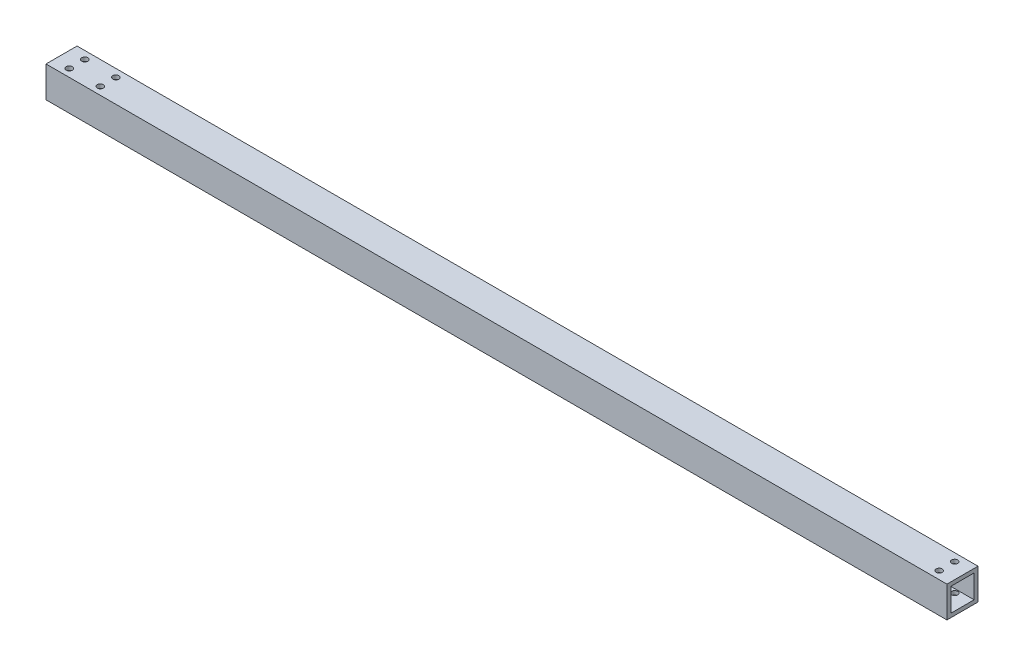
from build123d import *

# Parameters (mm, degrees)
EXTRUDE_THIN1_START             = 76.2
SKETCH5_W                       = 25.4
SKETCH5_H                       = 25.4
SKETCH5_W_2                     = 19.05
SKETCH5_H_2                     = 19.05
EXTRUDE_THIN1_DEPTH             = 736.6
F_5_0MM_DOWEL_HOLE1_D           = 5
F_5_0MM_DOWEL_HOLE1_CSINK_D     = 5.05
F_5_0MM_DOWEL_HOLE1_CSINK_ANGLE = 90


with BuildPart() as part:
    # Sketch5 → Extrude-Thin1 (new body)
    with BuildSketch(Plane(origin=(0, 0, 0), x_dir=(0, 0, -1), z_dir=(1, 0, 0)).offset(EXTRUDE_THIN1_START)):
        with Locations((101.6, 88.9)):
            Rectangle(SKETCH5_W, SKETCH5_H)
        with Locations((101.6, 88.9)):
            Rectangle(SKETCH5_W_2, SKETCH5_H_2, mode=Mode.SUBTRACT)
    extrude(amount=EXTRUDE_THIN1_DEPTH)

    # Ø5.0mm Dowel Hole1 (through all)
    with Locations(Plane(origin=(0, 76.2, 0), x_dir=(-1, 0, 0), z_dir=(0, -1, 0))):
        with Locations((-88.9, 107.95), (-88.9, 95.25), (-114.3, 107.95), (-114.3, 95.25), (-800.1, 107.95), (-800.1, 95.25)):
            CounterSinkHole(F_5_0MM_DOWEL_HOLE1_D / 2, F_5_0MM_DOWEL_HOLE1_CSINK_D / 2, counter_sink_angle=F_5_0MM_DOWEL_HOLE1_CSINK_ANGLE)


solid = part.part
